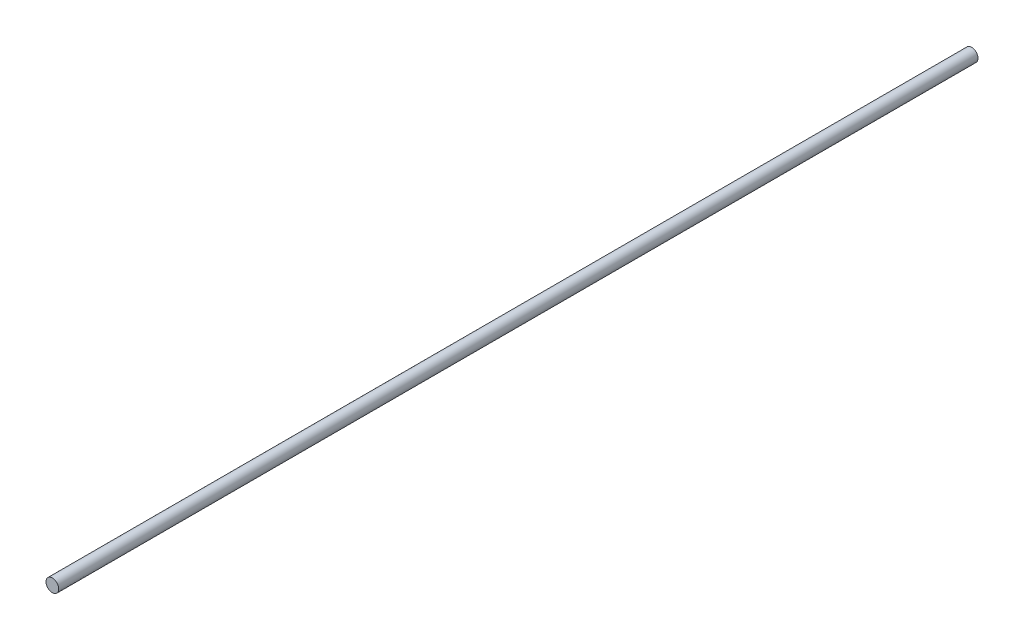
from build123d import *

# Parameters (mm, degrees)
SKETCH1_R           = 1.411111111
BOSS_EXTRUDE1_DEPTH = 203.2


with BuildPart() as part:
    # Sketch1 → Boss-Extrude1 (new body)
    with BuildSketch(Plane.XY):
        Circle(SKETCH1_R)
    extrude(amount=BOSS_EXTRUDE1_DEPTH)


solid = part.part
